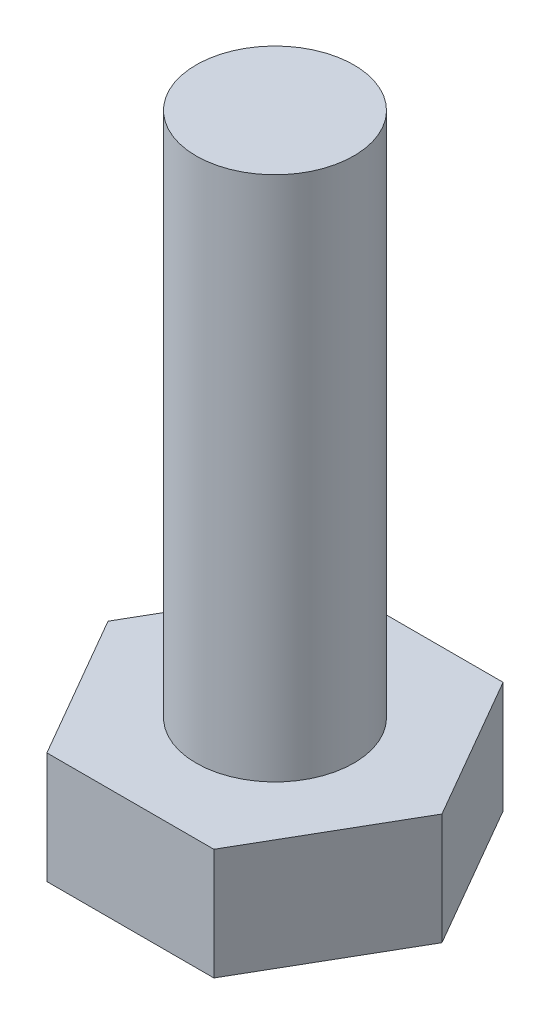
from build123d import *

# Parameters (mm, degrees)
SKETCH_1_R      = 1.5
EXTRUDE_1_DEPTH = 10
EXTRUDE_2_DEPTH = 2.12


with BuildPart() as part:
    # 草图1 → 凸台-拉伸1 (new body)
    with BuildSketch(Plane(origin=(0, 0, 0), x_dir=(1, 0, 0), z_dir=(0, 1, 0))):
        with Locations(Location((0, 0, 0), (0, 0, 270))):
            Circle(SKETCH_1_R)
    extrude(amount=EXTRUDE_1_DEPTH)

    # 草图3 → 凸台-拉伸2 (add)
    with BuildSketch(Plane.XZ):
        Polygon((3.175426481, 0), (1.58771324, 2.75), (-1.58771324, 2.75), (-3.175426481, 0), (-1.58771324, -2.75), (1.58771324, -2.75), align=None)
    extrude(amount=EXTRUDE_2_DEPTH)


solid = part.part
